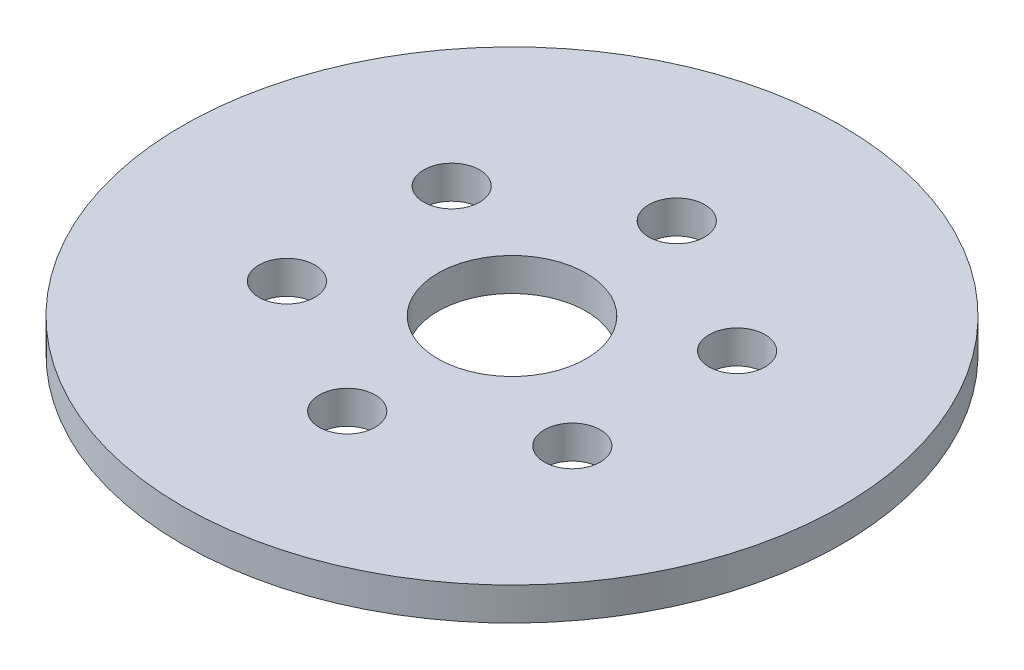
from build123d import *

# Parameters (mm, degrees)
SKETCH_1_R          = 20
SKETCH_1_R_2        = 4.5
EXTRUDE_1_DEPTH     = 2
SKETCH_2_R          = 1.7
CUT_EXTRUDE_1_DEPTH = 29.354893758


with BuildPart() as part:
    # 草图1 → 凸台-拉伸1 (new body)
    with BuildSketch(Plane(origin=(0, 0, 0), x_dir=(1, 0, 0), z_dir=(0, 1, 0))):
        with Locations(Location((0, 0, 0), (0, 0, 270))):
            Circle(SKETCH_1_R)
        with Locations(Location((0, 0, 0), (0, 0, 270))):
            Circle(SKETCH_1_R_2, mode=Mode.SUBTRACT)
    extrude(amount=EXTRUDE_1_DEPTH)

    # 草图2 → 切除-拉伸1 (cut, through all)
    with BuildSketch(Plane(origin=(0, 2, 0), x_dir=(1, 0, 0), z_dir=(0, 1, 0))):
        with Locations(Location((0, 10, 0), (0, 0, 270))):
            Circle(SKETCH_2_R)
        with Locations(Location((8.660254038, 5, 0), (0, 0, 270))):
            Circle(SKETCH_2_R)
        with Locations(Location((8.660254038, -5, 0), (0, 0, 270))):
            Circle(SKETCH_2_R)
        with Locations(Location((0, -10, 0), (0, 0, 270))):
            Circle(SKETCH_2_R)
        with Locations(Location((-8.660254038, -5, 0), (0, 0, 270))):
            Circle(SKETCH_2_R)
        with Locations(Location((-8.660254038, 5, 0), (0, 0, 270))):
            Circle(SKETCH_2_R)
    extrude(amount=-CUT_EXTRUDE_1_DEPTH, mode=Mode.SUBTRACT)


solid = part.part
